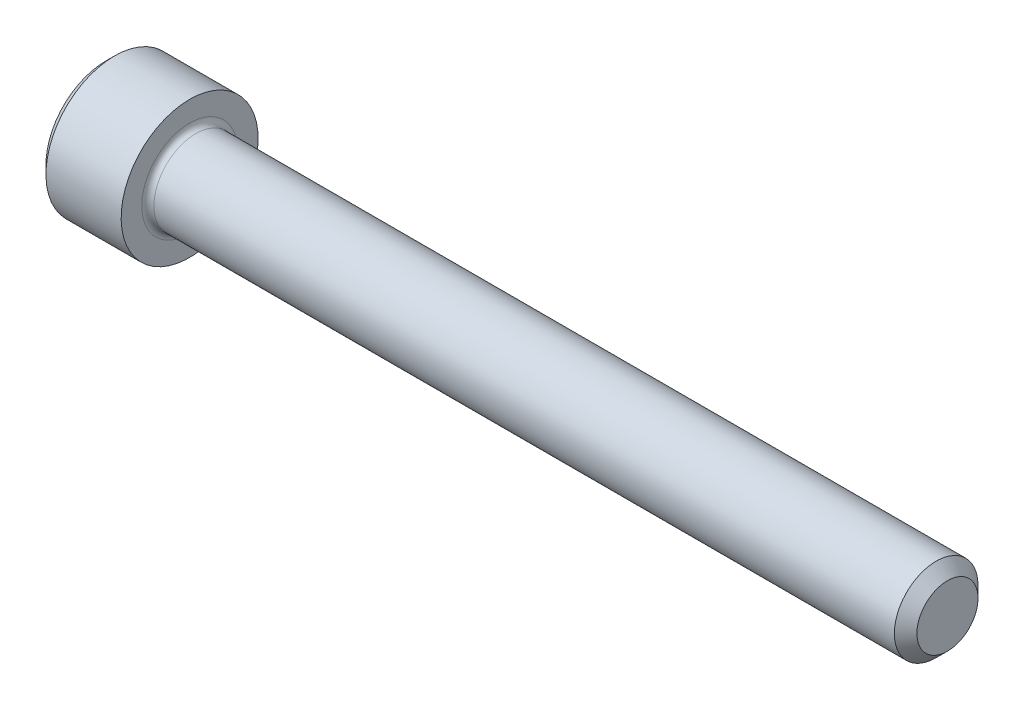
from build123d import *

# Parameters (mm, degrees)
HEX_2_DEPTH   = 1.6256
FILLET1_R     = 0.254
CHAMFER1_SIZE = 0.47244
CHAMFER2_SIZE = 0.3556


with BuildPart() as part:
    # Sketch1 → Base-Revolve (revolve)
    with BuildSketch(Plane.XY):
        Polygon((-3.5052, 0), (-3.5052, 2.8702), (0, 2.8702), (0, 1.7526), (31.75, 1.7526), (31.75, 0), align=None)
    revolve(axis=Axis((31.75, 0, 0), (-1, 0, 0)))

    # Sketch2 → Hex-PreBroach (revolve, cut)
    with BuildSketch(Plane.XY, mode=Mode.PRIVATE) as hex_prebroach_sk:
        Polygon((-3.5052, 1.3843), (-1.8796, 1.3843), (-1.080374022, 0), (-3.5052, 0), align=None)
    revolve(hex_prebroach_sk.sketch.rotate(Axis((31.75, 0, 0), (-1, 0, 0)), 180), axis=Axis((31.75, 0, 0), (-1, 0, 0)), mode=Mode.SUBTRACT)

    # Sketch3 → Hex 2 (cut)
    with BuildSketch(Plane(origin=(-3.5052, 0, 0), x_dir=(0, 0.500000000000001, 0.866025403784438), z_dir=(-1, 0, 0))):
        Polygon((0.799225978, 1.3843), (-0.799225978, 1.3843), (-1.598451955, 0), (-0.799225978, -1.3843), (0.799225978, -1.3843), (1.598451955, 0), align=None)
    extrude(amount=-HEX_2_DEPTH, mode=Mode.SUBTRACT)

    # Fillet1
    fillet1_edges = [part.edges().sort_by_distance(p)[0] for p in [
        (0, -1.7526, 0),
    ]]
    fillet(fillet1_edges, radius=FILLET1_R)

    # Chamfer1
    chamfer1_edges = [part.edges().sort_by_distance(p)[0] for p in [
        (31.75, -1.7526, 0),
    ]]
    chamfer(chamfer1_edges, length=CHAMFER1_SIZE)

    # Chamfer2
    chamfer2_edges = [part.edges().sort_by_distance(p)[0] for p in [
        (-3.5052, -2.8702, 0),
    ]]
    chamfer(chamfer2_edges, length=CHAMFER2_SIZE)


solid = part.part
